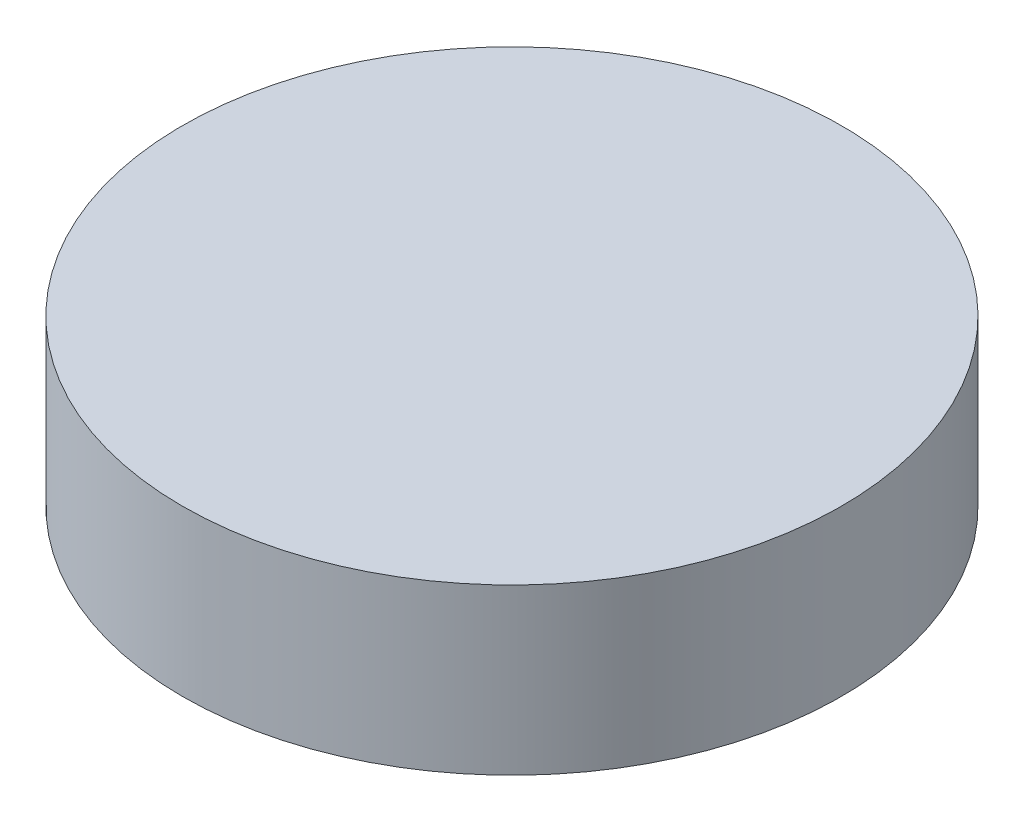
from build123d import *

# Parameters (mm, degrees)
SKETCH1_R           = 6.35
BOSS_EXTRUDE1_DEPTH = 3.175


with BuildPart() as part:
    # Sketch1 → Boss-Extrude1 (new body)
    with BuildSketch(Plane(origin=(0, 0, 0), x_dir=(1, 0, 0), z_dir=(0, 1, 0))):
        with Locations(Location((0, 0, 0), (0, 0, 270))):
            Circle(SKETCH1_R)
    extrude(amount=BOSS_EXTRUDE1_DEPTH)


solid = part.part
